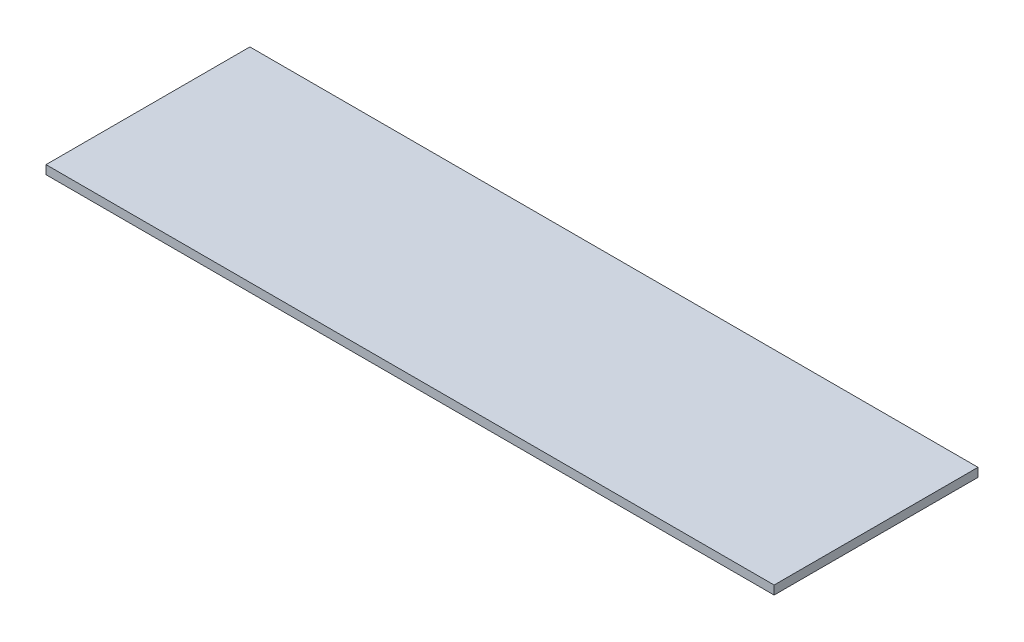
from build123d import *

# Parameters (mm, degrees)
SKETCH1_W           = 250
SKETCH1_H           = 70
BOSS_EXTRUDE1_DEPTH = 3


with BuildPart() as part:
    # Sketch1 → Boss-Extrude1 (new body)
    with BuildSketch(Plane(origin=(0, 0, 0), x_dir=(1, 0, 0), z_dir=(0, 1, 0))):
        Rectangle(SKETCH1_W, SKETCH1_H)
    extrude(amount=BOSS_EXTRUDE1_DEPTH)


solid = part.part
